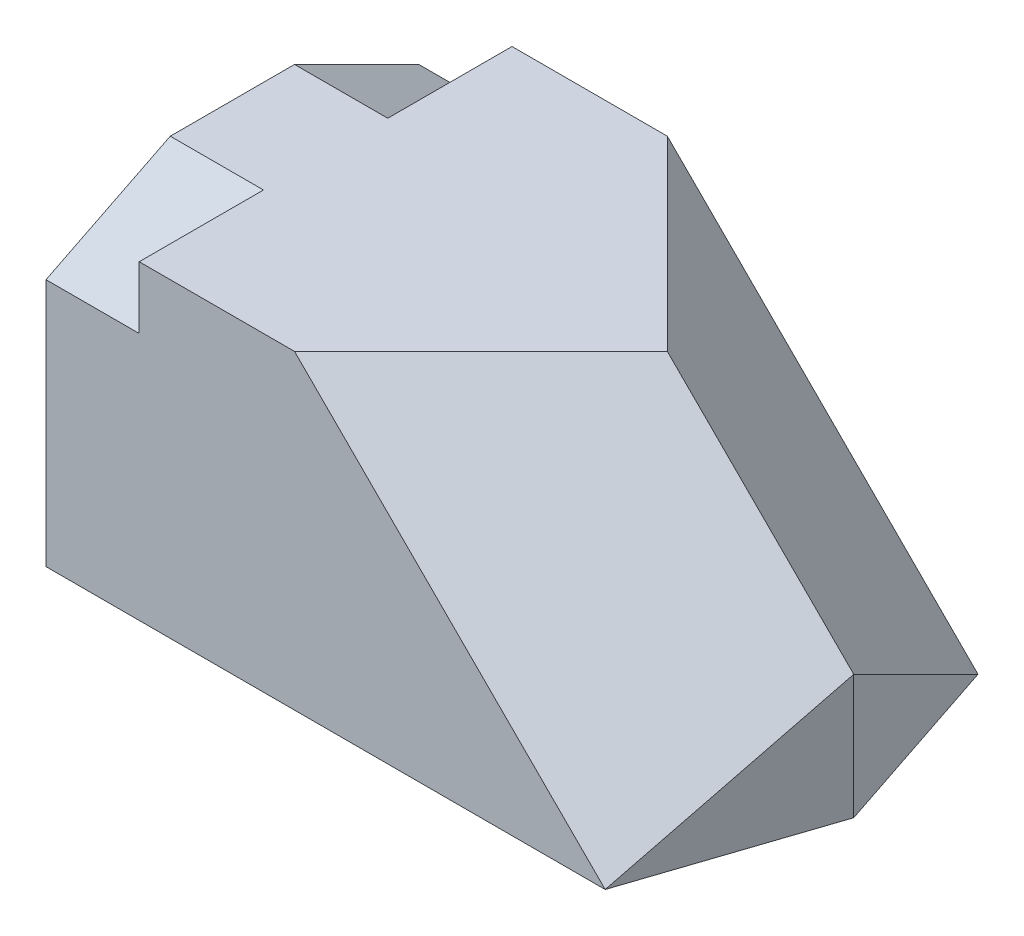
from build123d import *

# Parameters (mm, degrees)
CROQUIS2_W              = 100
CROQUIS2_H              = 50
SALIENTE_EXTRUIR1_DEPTH = 30
CORTAR_EXTRUIR1_START   = -15
CORTAR_EXTRUIR1_DEPTH   = 131.758369028
CORTAR_EXTRUIR2_DEPTH   = 20
CORTAR_EXTRUIR3_DEPTH   = 165.121269


with BuildPart() as part:
    # Croquis2 → Saliente-Extruir1 (new, symmetric)
    with BuildSketch(Plane.XY):
        with Locations((50, 25)):
            Rectangle(CROQUIS2_W, CROQUIS2_H)
    extrude(amount=SALIENTE_EXTRUIR1_DEPTH, both=True)

    # Croquis4 → Cortar-Extruir1 (cut)
    with BuildSketch(Plane.ZY.offset(CORTAR_EXTRUIR1_START)):
        Polygon((30, 40), (10, 50), (30, 50), align=None)
    cortar_extruir1 = extrude(amount=CORTAR_EXTRUIR1_DEPTH, mode=Mode.SUBTRACT)

    # Croquis6 → Cortar-Extruir2 (cut)
    with BuildSketch(Plane.XZ):
        Polygon((100, 0), (100, 30), (90, 30), align=None)
    cortar_extruir2 = extrude(amount=-CORTAR_EXTRUIR2_DEPTH, mode=Mode.SUBTRACT)

    # Croquis16 → Cortar-Extruir3 (cut, through all, along a direction that is not the sketch's normal)
    with BuildSketch(Plane(origin=(0, 50, 0), x_dir=(1, 0, 0), z_dir=(0, 1, 0))):
        Polygon((100, 0), (70, 0), (40, -30), (100, -30), align=None)
    cortar_extruir3 = extrude(amount=-CORTAR_EXTRUIR3_DEPTH, dir=(-0.7071067811865474, 0.7071067811865478, 0), mode=Mode.SUBTRACT)

    # Simetría2: Cortar-Extruir1, Cortar-Extruir2, Cortar-Extruir3 across plane
    add(cortar_extruir1.mirror(Plane.XY), mode=Mode.SUBTRACT)
    add(cortar_extruir2.mirror(Plane.XY), mode=Mode.SUBTRACT)
    add(cortar_extruir3.mirror(Plane.XY), mode=Mode.SUBTRACT)


solid = part.part
